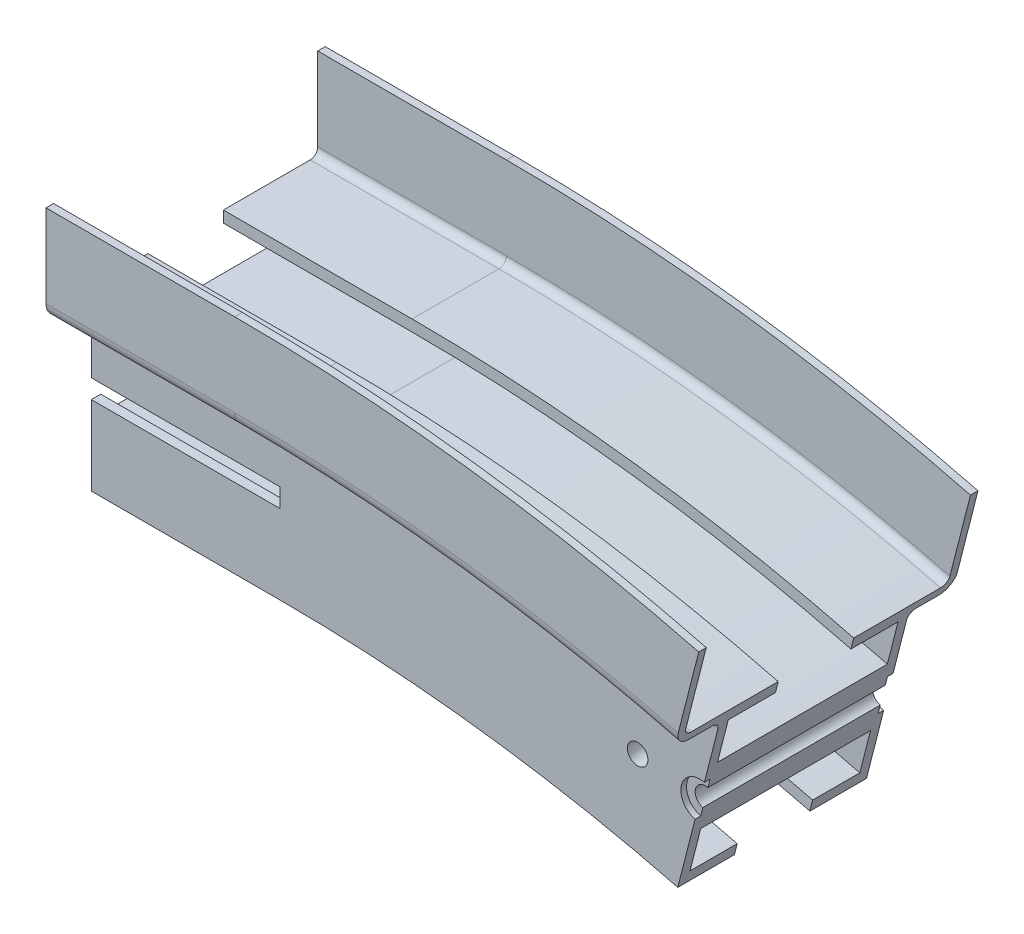
from build123d import *

# Parameters (mm, degrees)
ESTRUSIONE_ESTRUSIONE1_DEPTH = 50
SMUSSO1_SIZE                 = 1.6
RIVOLUZIONE1_ANGLE           = 14.31
FORO_PER_VITE_M5_1_D         = 5.4
FORO_PER_VITE_M5_1_DEPTH     = 160
FORO_PER_VITE_M5_1_TIP       = 1.622323671


with BuildPart() as part:
    # Schizzo1 → Estrusione-Estrusione1 (new body)
    with BuildSketch(Plane(origin=(0, 0, 0), x_dir=(0, 0, -1), z_dir=(1, 0, 0))):
        with BuildLine():
            Line((-10, -23.5), (-10, -20.5))
            Line((-10, -20.5), (-22.5, -20.5))
            Line((-22.5, -20.5), (-22.5, -9))
            Line((-22.5, -9), (22.5, -9))
            Line((22.5, -9), (22.5, -20.5))
            Line((22.5, -20.5), (10, -20.5))
            Line((10, -20.5), (10, -23.5))
            Line((10, -23.5), (25, -23.5))
            Line((25, -23.5), (25, -2.5))
            Line((25, -2.5), (22.5, -2.5))
            Line((22.5, -2.5), (22.5, -7))
            Line((22.5, -7), (12.5, -7))
            Line((12.5, -7), (12.5, 7))
            Line((12.5, 7), (22.5, 7))
            Line((22.5, 7), (22.5, 2.5))
            Line((22.5, 2.5), (25, 2.5))
            Line((25, 2.5), (25, 19.5))
            ThreePointArc((25, 19.5), (25.585786438, 20.914213562), (27, 21.5))
            Line((27, 21.5), (33, 21.5))
            ThreePointArc((33, 21.5), (35.828427125, 22.671572875), (37, 25.5))
            Line((37, 25.5), (37, 47.5))
            Line((37, 47.5), (35, 47.5))
            Line((35, 47.5), (35, 25.5))
            ThreePointArc((35, 25.5), (34.414213562, 24.085786438), (33, 23.5))
            Line((33, 23.5), (10, 23.5))
            Line((10, 23.5), (10, 20.5))
            Line((10, 20.5), (22.5, 20.5))
            Line((22.5, 20.5), (22.5, 9))
            Line((22.5, 9), (-22.5, 9))
            Line((-22.5, 9), (-22.5, 20.5))
            Line((-22.5, 20.5), (-10, 20.5))
            Line((-10, 20.5), (-10, 23.5))
            Line((-10, 23.5), (-33, 23.5))
            ThreePointArc((-33, 23.5), (-34.414213562, 24.085786438), (-35, 25.5))
            Line((-35, 25.5), (-35, 47.5))
            Line((-35, 47.5), (-37, 47.5))
            Line((-37, 47.5), (-37, 25.5))
            ThreePointArc((-37, 25.5), (-35.828427125, 22.671572875), (-33, 21.5))
            Line((-33, 21.5), (-27, 21.5))
            ThreePointArc((-27, 21.5), (-25.585786438, 20.914213562), (-25, 19.5))
            Line((-25, 19.5), (-25, 2.5))
            Line((-25, 2.5), (-22.5, 2.5))
            Line((-22.5, 2.5), (-22.5, 7))
            Line((-22.5, 7), (-12.5, 7))
            Line((-12.5, 7), (-12.5, -7))
            Line((-12.5, -7), (-22.5, -7))
            Line((-22.5, -7), (-22.5, -2.5))
            Line((-22.5, -2.5), (-25, -2.5))
            Line((-25, -2.5), (-25, -23.5))
            Line((-25, -23.5), (-10, -23.5))
        make_face()
        with BuildLine():
            Line((-8.5, 7), (8.5, 7))
            ThreePointArc((8.5, 7), (9.560660172, 6.560660172), (10, 5.5))
            Line((10, 5.5), (10, -5.5))
            ThreePointArc((10, -5.5), (9.560660172, -6.560660172), (8.5, -7))
            Line((8.5, -7), (-8.5, -7))
            ThreePointArc((-8.5, -7), (-9.560660172, -6.560660172), (-10, -5.5))
            Line((-10, -5.5), (-10, 5.5))
            ThreePointArc((-10, 5.5), (-9.560660172, 6.560660172), (-8.5, 7))
        make_face(mode=Mode.SUBTRACT)
    extrude(amount=ESTRUSIONE_ESTRUSIONE1_DEPTH)

    # Smusso1
    smusso1_edges = [part.edges().sort_by_distance(p)[0] for p in [
        (25, -7, 22.5),
        (25, -7, 12.5),
        (25, 7, 12.5),
        (25, 7, 22.5),
        (25, 7, -22.5),
        (25, 7, -12.5),
        (25, -7, -12.5),
        (25, -7, -22.5),
    ]]
    chamfer(smusso1_edges, length=SMUSSO1_SIZE)

    # Schizzo2 → Rivoluzione1 (revolve)
    with BuildSketch(Plane(origin=(50, 0, 0), x_dir=(0, 0, -1), z_dir=(1, 0, 0))):
        with BuildLine():
            Line((-10, -23.5), (-25, -23.5))
            Line((-25, -23.5), (-25, 19.5))
            ThreePointArc((-25, 19.5), (-25.585786438, 20.914213562), (-27, 21.5))
            Line((-27, 21.5), (-33, 21.5))
            ThreePointArc((-33, 21.5), (-35.828427125, 22.671572875), (-37, 25.5))
            Line((-37, 25.5), (-37, 47.5))
            Line((-37, 47.5), (-35, 47.5))
            Line((-35, 47.5), (-35, 25.5))
            ThreePointArc((-35, 25.5), (-34.414213562, 24.085786438), (-33, 23.5))
            Line((-33, 23.5), (-10, 23.5))
            Line((-10, 23.5), (-10, 20.5))
            Line((-10, 20.5), (-22.5, 20.5))
            Line((-22.5, 20.5), (-22.5, 9))
            Line((-22.5, 9), (22.5, 9))
            Line((22.5, 9), (22.5, 20.5))
            Line((22.5, 20.5), (10, 20.5))
            Line((10, 20.5), (10, 23.5))
            Line((10, 23.5), (33, 23.5))
            ThreePointArc((33, 23.5), (34.414213562, 24.085786438), (35, 25.5))
            Line((35, 25.5), (35, 47.5))
            Line((35, 47.5), (37, 47.5))
            Line((37, 47.5), (37, 25.5))
            ThreePointArc((37, 25.5), (35.828427125, 22.671572875), (33, 21.5))
            Line((33, 21.5), (27, 21.5))
            ThreePointArc((27, 21.5), (25.585786438, 20.914213562), (25, 19.5))
            Line((25, 19.5), (25, -23.5))
            Line((25, -23.5), (10, -23.5))
            Line((10, -23.5), (10, -20.5))
            Line((10, -20.5), (22.5, -20.5))
            Line((22.5, -20.5), (22.5, -9))
            Line((22.5, -9), (-22.5, -9))
            Line((-22.5, -9), (-22.5, -20.5))
            Line((-22.5, -20.5), (-10, -20.5))
            Line((-10, -20.5), (-10, -23.5))
        make_face()
    revolve(axis=Axis((50, -450, 89.886149412), (0, 0, -1)), revolution_arc=RIVOLUZIONE1_ANGLE)

    # Schizzo18 → Taglia-Rivoluzione1 (revolve, cut)
    with BuildSketch(Plane(origin=(154.720013769, -39.4663965, 0), x_dir=(0, 0, 1), z_dir=(0.968972607187923, -0.24716813411004132, 0))):
        Polygon((25, -26.320733471), (-25, -26.320733471), (-25, -21.320733471), (-23.5, -21.320733471), (-23.5, -23.620733471), (23.5, -23.620733471), (23.5, -21.320733471), (25, -21.320733471), align=None)
    revolve(axis=Axis((161.22566035, -13.962326765, 25), (0, 0, -1)), mode=Mode.SUBTRACT)

    # Foro per Vite M5-1
    with Locations(Plane(origin=(-7.210145196, 0, -54.766490026), x_dir=(0.9914448613738105, 0, -0.13052619222005182), z_dir=(-0.13052619222005182, 0, -0.9914448613738105))):
        with Locations((140.267423642, 11.462325347)):
            Hole(FORO_PER_VITE_M5_1_D / 2, depth=FORO_PER_VITE_M5_1_DEPTH)
            with Locations((0, 0, -(FORO_PER_VITE_M5_1_DEPTH + FORO_PER_VITE_M5_1_TIP / 2))):  # 118° drill point
                Cone(0, FORO_PER_VITE_M5_1_D / 2, FORO_PER_VITE_M5_1_TIP, mode=Mode.SUBTRACT)


solid = part.part
